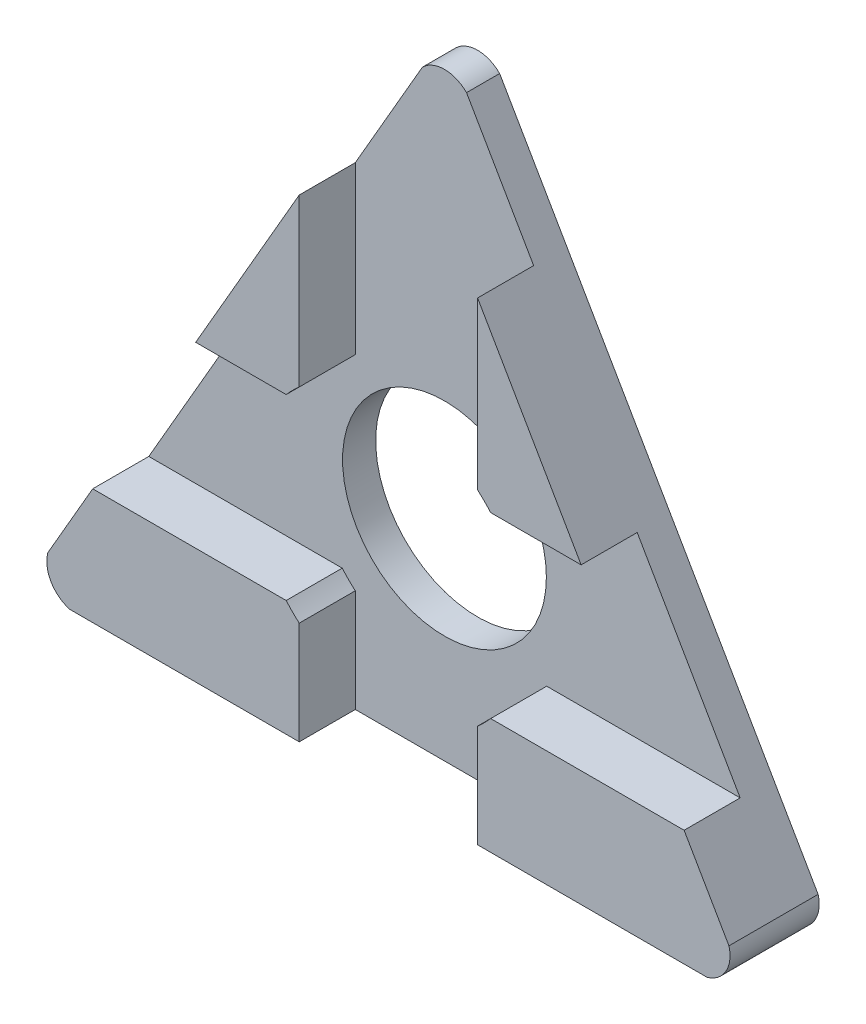
from build123d import *

# Parameters (mm, degrees)
EXTRUDE_1_DEPTH     = 3.5
EXTRUDE_8_DEPTH     = 3.5
SKETCH_12_R         = 4
CUT_EXTRUDE_1_DEPTH = 27.432726041
SKETCH_13_R         = 5.325
CUT_EXTRUDE_2_DEPTH = 2.2
CUT_EXTRUDE_3_DEPTH = 2.2


with BuildPart() as part:
    # ｽｹｯﾁ1 → ﾎﾞｽ - 押し出し1 (new body)
    with BuildSketch(Plane.XY):
        Polygon((0, 21.650635095), (-12.5, 0), (12.5, 0), align=None)
    extrude(amount=EXTRUDE_1_DEPTH)

    # ｽｹｯﾁ11 → ﾎﾞｽ - 押し出し8 (add, through all)
    with BuildSketch(Plane(origin=(0, 0, 0), x_dir=(-1, 0, 0), z_dir=(0, 0, -1))):
        with BuildLine():
            Line((0.866025404, 22.150635095), (13.366025404, 0.5))
            ThreePointArc((13.366025404, 0.5), (13.243672874, -0.429359734), (12.5, -1))
            Line((12.5, -1), (-12.5, -1))
            ThreePointArc((-12.5, -1), (-13.243672874, -0.429359734), (-13.366025404, 0.5))
            Line((-13.366025404, 0.5), (-0.866025404, 22.150635095))
            ThreePointArc((-0.866025404, 22.150635095), (0, 22.509354562), (0.866025404, 22.150635095))
        make_face()
        Polygon((0, 21.650635095), (12.5, 0), (-12.5, 0), align=None, mode=Mode.SUBTRACT)
    extrude(amount=-EXTRUDE_8_DEPTH)

    # ｽｹｯﾁ12 → ｶｯﾄ - 押し出し1 (cut, through all)
    with BuildSketch(Plane.XY.offset(3.5)):
        with Locations((0, 7.24327674)):
            Circle(SKETCH_12_R)
    extrude(amount=-CUT_EXTRUDE_1_DEPTH, mode=Mode.SUBTRACT)

    # ｽｹｯﾁ13 → ｶｯﾄ - 押し出し2 (cut)
    with BuildSketch(Plane.XY.offset(3.5)):
        with Locations((0, 7.048781332)):
            Circle(SKETCH_13_R)
    extrude(amount=-CUT_EXTRUDE_2_DEPTH, mode=Mode.SUBTRACT)

    # ｽｹｯﾁ14 → ｶｯﾄ - 押し出し3 (cut)
    with BuildSketch(Plane.XY.offset(3.5)):
        Polygon((-3.5, 24.86994882), (3.5, 24.86994882), (3.5, 10.548781332), (20.875633237, 10.548781332), (20.875633237, 3.548781332), (3.5, 3.548781332), (3.5, -2.871018352), (-3.5, -2.871018352), (-3.5, 3.548781332), (-19.259035821, 3.548781332), (-19.259035821, 10.548781332), (-3.5, 10.548781332), align=None)
    extrude(amount=-CUT_EXTRUDE_3_DEPTH, mode=Mode.SUBTRACT)


solid = part.part
